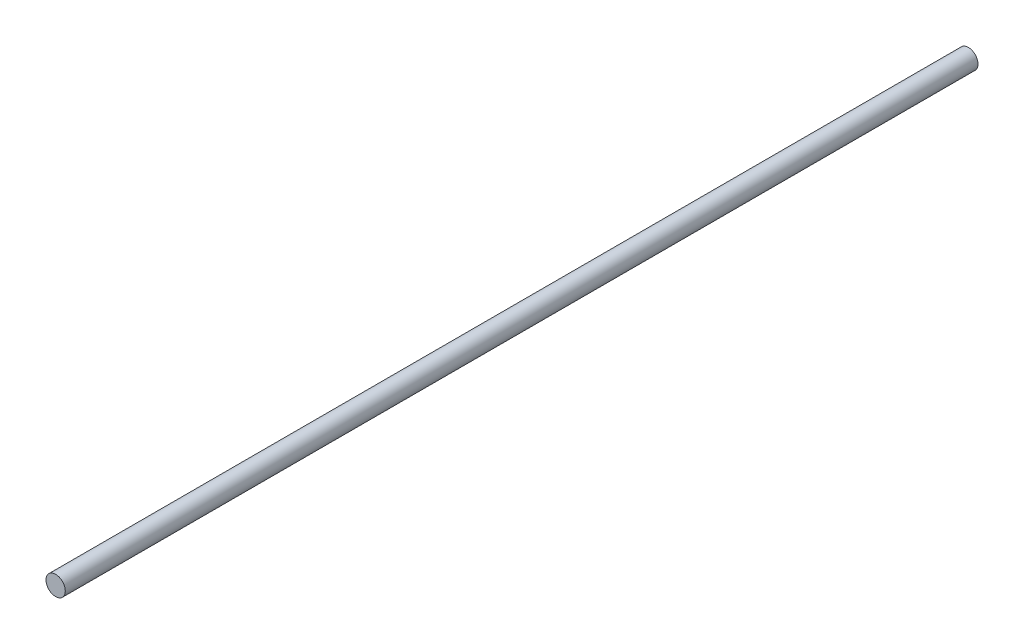
from build123d import *

# Parameters (mm, degrees)
SKETCH_1_W = 2.75
SKETCH_1_H = 260


with BuildPart() as part:
    # Эскиз1 → Повернуть1 (revolve)
    with BuildSketch(Plane(origin=(0, 0, 0), x_dir=(1, 0, 0), z_dir=(0, 1, 0))):
        with Locations((1.375, -130)):
            Rectangle(SKETCH_1_W, SKETCH_1_H)
    revolve(axis=Axis((0, 0, 0), (0, 0, 1)))


solid = part.part
